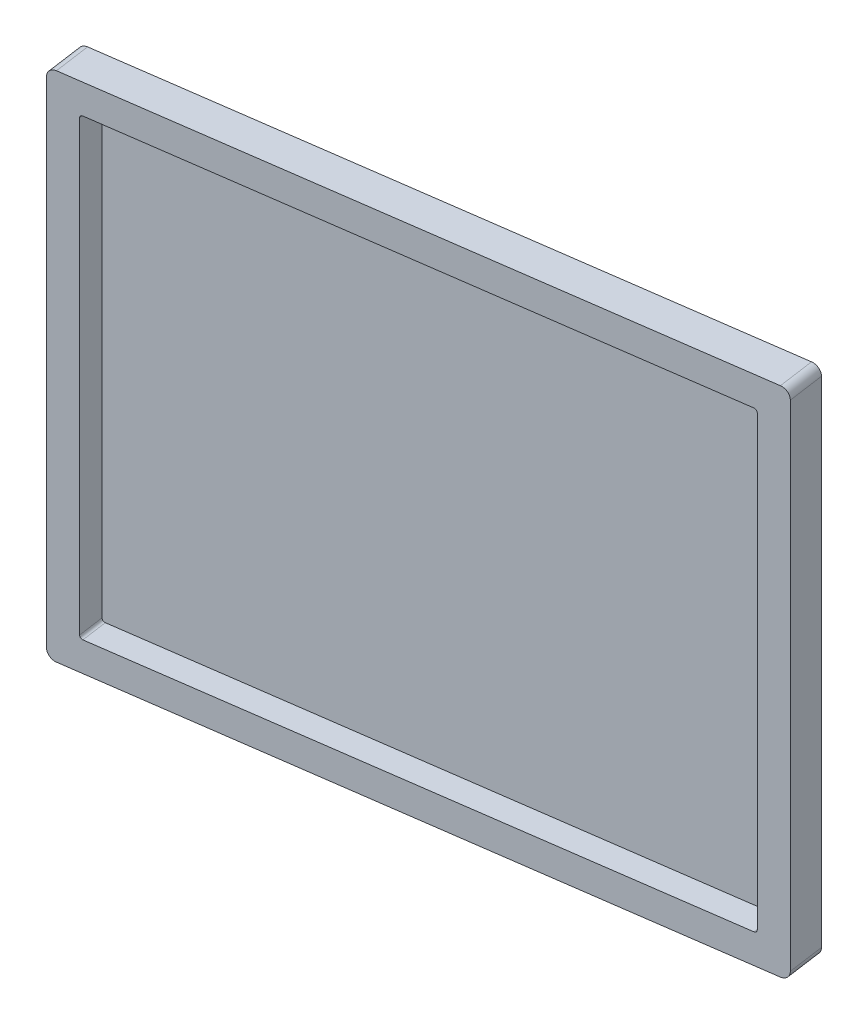
from build123d import *

# Parameters (mm, degrees)
EXTRUDE_START          = -12.5
EXTRUDE_1_DEPTH        = 25
EXTRUDE_ROTATE_1_ANGLE = 8
EXTRUDE_START_2        = -8.5
EXTRUDE_SKETCH_2_W     = 410
EXTRUDE_SKETCH_2_H     = 310
EXTRUDE_2_DEPTH        = 3
EXTRUDE_ROTATE_2_ANGLE = 8
EXTRUDE_START_3        = -30.5
EXTRUDE_SKETCH_3_W     = 80
EXTRUDE_SKETCH_3_H     = 80
EXTRUDE_3_DEPTH        = 22
EXTRUDE_ROTATE_3_ANGLE = 8


with BuildPart() as part:
    # Extrude sketch 1 → Extrude 1 (new body)
    with BuildSketch(Plane.XY.offset(EXTRUDE_START)):
        with BuildLine():
            Line((219, 175), (-219, 175))
            ThreePointArc((-219, 175), (-223.242640687, 173.242640687), (-225, 169))
            Line((-225, 169), (-225, -169))
            ThreePointArc((-225, -169), (-223.242640687, -173.242640687), (-219, -175))
            Line((-219, -175), (219, -175))
            ThreePointArc((219, -175), (223.242640687, -173.242640687), (225, -169))
            Line((225, -169), (225, 169))
            ThreePointArc((225, 169), (223.242640687, 173.242640687), (219, 175))
        make_face()
        with BuildLine():
            Line((203, 155), (-203, 155))
            ThreePointArc((-203, 155), (-204.414213562, 154.414213562), (-205, 153))
            Line((-205, 153), (-205, -153))
            ThreePointArc((-205, -153), (-204.414213562, -154.414213562), (-203, -155))
            Line((-203, -155), (203, -155))
            ThreePointArc((203, -155), (204.414213562, -154.414213562), (205, -153))
            Line((205, -153), (205, 153))
            ThreePointArc((205, 153), (204.414213562, 154.414213562), (203, 155))
        make_face(mode=Mode.SUBTRACT)
    extrude(amount=EXTRUDE_1_DEPTH)


with BuildPart() as part_1:
    # Extrude rotate 1: moved
    add(part.part.rotate(Axis((0, 0, 0), (0, 1, 0)), EXTRUDE_ROTATE_1_ANGLE))


with BuildPart() as part_2:
    # Extrude place 1: moved
    add(part_1.part.moved(Location((588.929348295, 0, 623.692298575))))


with BuildPart() as body_2:
    # Extrude sketch 2 → Extrude 2 (new body)
    with BuildSketch(Plane.XY.offset(EXTRUDE_START_2)):
        Rectangle(EXTRUDE_SKETCH_2_W, EXTRUDE_SKETCH_2_H)
    extrude(amount=EXTRUDE_2_DEPTH)


with BuildPart() as body_2_1:
    # Extrude rotate 2: moved
    add(body_2.part.rotate(Axis((0, 0, 0), (0, 1, 0)), EXTRUDE_ROTATE_2_ANGLE))


with BuildPart() as body_2_2:
    # Extrude place 2: moved
    add(body_2_1.part.moved(Location((588.929348295, 0, 623.692298575))))


with BuildPart() as body_3:
    # Extrude sketch 3 → Extrude 3 (new body)
    with BuildSketch(Plane.XY.offset(EXTRUDE_START_3)):
        with Locations((100, 0)):
            Rectangle(EXTRUDE_SKETCH_3_W, EXTRUDE_SKETCH_3_H)
    extrude(amount=EXTRUDE_3_DEPTH)


with BuildPart() as body_3_1:
    # Extrude rotate 3: moved
    add(body_3.part.rotate(Axis((0, 0, 0), (0, 1, 0)), EXTRUDE_ROTATE_3_ANGLE))


with BuildPart() as body_3_2:
    # Extrude place 3: moved
    add(body_3_1.part.moved(Location((588.929348295, 0, 623.692298575))))


with BuildPart() as part_3:
    add(part_2.part)

    # Combine (weld / assembly of features): union body 3, body 2
    add(body_3_2.part)
    add(body_2_2.part)


solid = part_3.part
